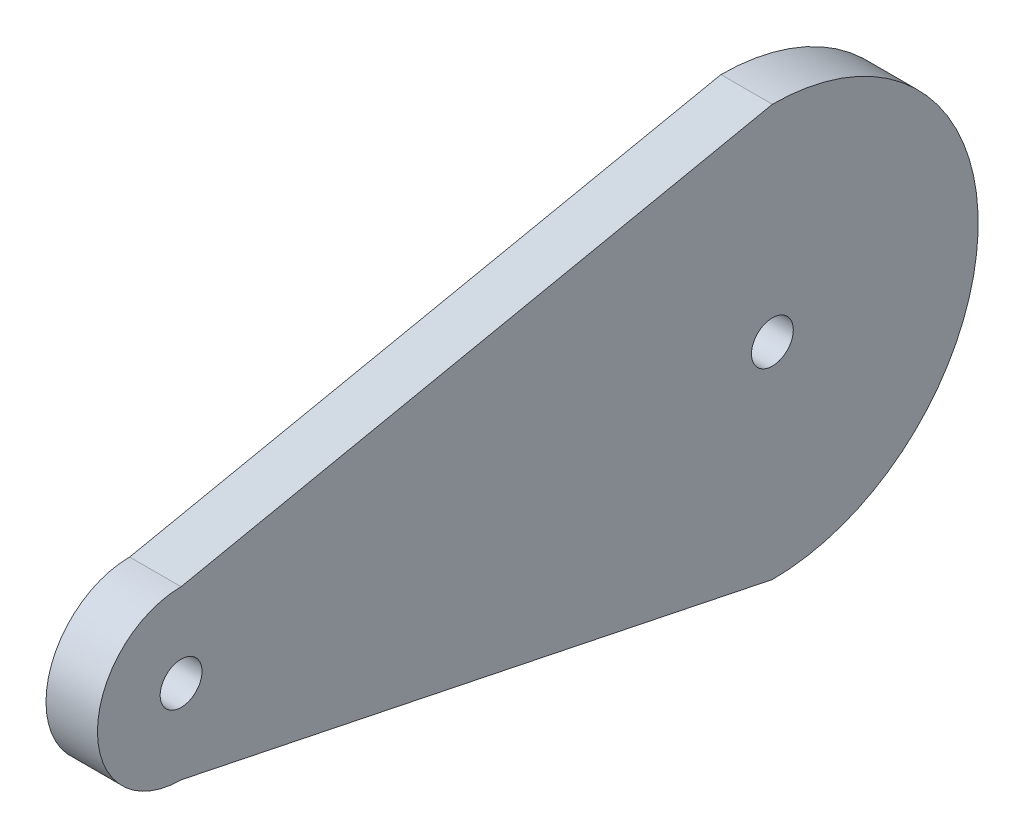
from build123d import *

# Parameters (mm, degrees)
SKETCH1_R           = 2.580823706
BOSS_EXTRUDE1_DEPTH = 6.35


with BuildPart() as part:
    # Sketch1 → Boss-Extrude1 (new body)
    with BuildSketch(Plane(origin=(0, 0, 0), x_dir=(0, 0, -1), z_dir=(1, 0, 0))):
        with BuildLine():
            ThreePointArc((0, 10.323294823), (-10.323294823, 0), (0, -10.323294823))
            Line((0, -10.323294823), (72.9742, -25.4))
            ThreePointArc((72.9742, -25.4), (98.3742, 0), (72.9742, 25.4))
            Line((72.9742, 25.4), (0, 10.323294823))
        make_face()
        Circle(SKETCH1_R, mode=Mode.SUBTRACT)
        with Locations((72.9742, 0)):
            Circle(SKETCH1_R, mode=Mode.SUBTRACT)
    extrude(amount=BOSS_EXTRUDE1_DEPTH)


solid = part.part
